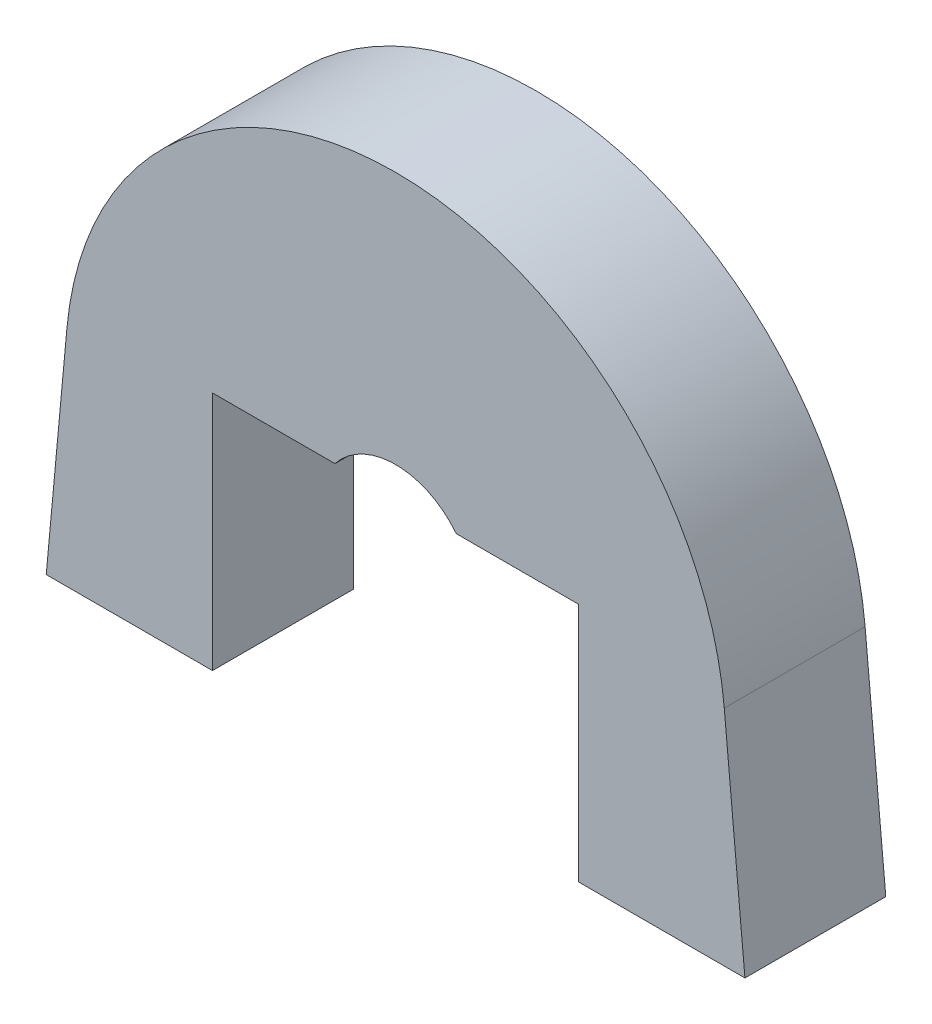
from build123d import *

# Parameters (mm, degrees)
SALIENTE_EXTRUIR1_DEPTH = 3.2
CROQUIS2_R              = 1.5
CORTAR_EXTRUIR1_DEPTH   = 5


with BuildPart() as part:
    # Croquis1 → Saliente-Extruir1 (new, symmetric)
    with BuildSketch(Plane.XY):
        with BuildLine():
            Line((15.875, -8.77), (8.32, -8.77))
            Line((8.32, -8.77), (8.32, 2.157309855))
            Line((8.32, 2.157309855), (2.756086753, 2.157309855))
            ThreePointArc((2.756086753, 2.157309855), (0, 3.5), (-2.756086753, 2.157309855))
            Line((-2.756086753, 2.157309855), (-8.32, 2.157309855))
            Line((-8.32, 2.157309855), (-8.32, -8.77))
            Line((-8.32, -8.77), (-15.875, -8.77))
            Line((-15.875, -8.77), (-14.93627212, 1.381222339))
            ThreePointArc((-14.93627212, 1.381222339), (0, 15), (14.93627212, 1.381222339))
            Line((14.93627212, 1.381222339), (15.875, -8.77))
        make_face()
    extrude(amount=SALIENTE_EXTRUIR1_DEPTH, both=True)

    # Croquis2 → Cortar-Extruir1 (cut)
    with BuildSketch(Plane.XZ.offset(8.77)):
        with Locations((-12.7, 0)):
            Circle(CROQUIS2_R)
        with Locations(Location((12.7, 0, 0), (0, 0, 180))):
            Circle(CROQUIS2_R)
    extrude(amount=-CORTAR_EXTRUIR1_DEPTH, mode=Mode.SUBTRACT)


solid = part.part
